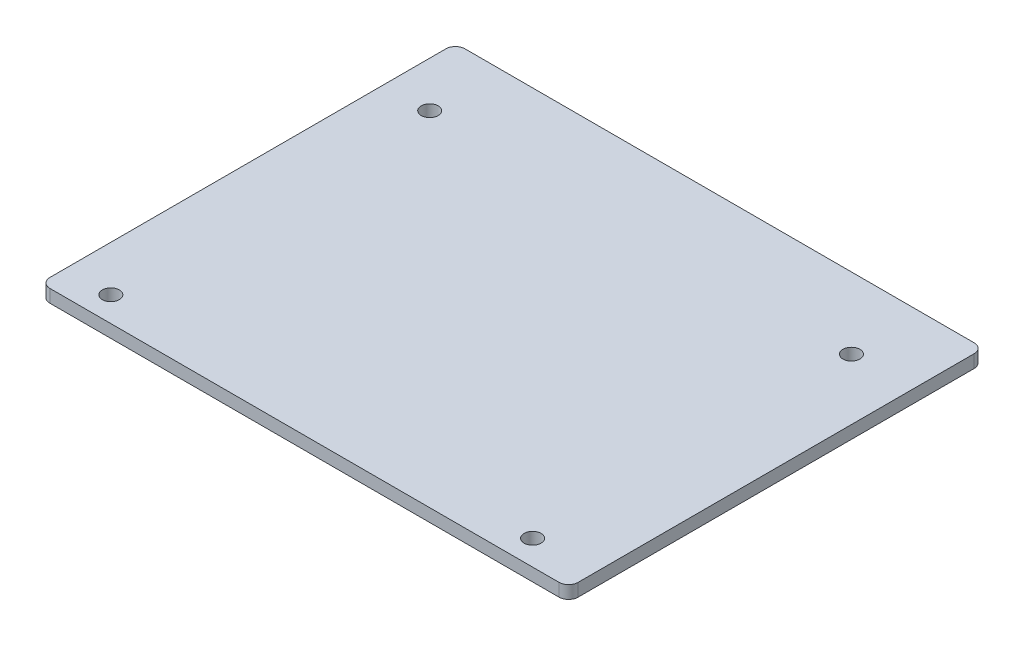
from build123d import *

# Parameters (mm, degrees)
SKETCH_1_W          = 103
SKETCH_1_H          = 81
EXTRUDE_1_DEPTH     = 2.5
FILLET_1_R          = 2
SKETCH_2_R          = 1.65
CUT_EXTRUDE_1_DEPTH = 66.56485339
CUT_EXTRUDE_2_DEPTH = 66.56485339


with BuildPart() as part:
    # 草图1 → 凸台-拉伸1 (new body)
    with BuildSketch(Plane(origin=(0, 0, 0), x_dir=(1, 0, 0), z_dir=(0, 1, 0))):
        Rectangle(SKETCH_1_W, SKETCH_1_H)
    extrude(amount=EXTRUDE_1_DEPTH)

    # 圆角1
    fillet_1_edges = [part.edges().sort_by_distance(p)[0] for p in [
        (51.5, 1.25, 40.5),
        (-51.5, 1.25, 40.5),
        (-51.5, 1.25, -40.5),
        (51.5, 1.25, -40.5),
    ]]
    fillet(fillet_1_edges, radius=FILLET_1_R)

    # 草图2 → 切除-拉伸1 (cut, through all)
    with BuildSketch(Plane(origin=(0, 2.5, 0), x_dir=(1, 0, 0), z_dir=(0, 1, 0))):
        with Locations(Location((-42.5, 26.5, 0), (0, 0, 270))):
            Circle(SKETCH_2_R)
        with Locations(Location((39.5, 26.5, 0), (0, 0, 270))):
            Circle(SKETCH_2_R)
        with Locations(Location((39.5, -35.5, 0), (0, 0, 270))):
            Circle(SKETCH_2_R)
        with Locations(Location((-42.5, -35.5, 0), (0, 0, 270))):
            Circle(SKETCH_2_R)
    extrude(amount=-CUT_EXTRUDE_1_DEPTH, mode=Mode.SUBTRACT)

    # 草图3 → 切除-拉伸2 (cut, through all)
    with BuildSketch(Plane(origin=(0, 2.5, 0), x_dir=(1, 0, 0), z_dir=(0, 1, 0))):
        with BuildLine():
            Line((49.5, 40.5), (-49.5, 40.5))
            ThreePointArc((-49.5, 40.5), (-50.914213562, 39.914213562), (-51.5, 38.5))
            Line((-51.5, 38.5), (-51.5, -38.5))
            ThreePointArc((-51.5, -38.5), (-50.914213562, -39.914213562), (-49.5, -40.5))
            Line((-49.5, -40.5), (49.5, -40.5))
            ThreePointArc((49.5, -40.5), (50.914213562, -39.914213562), (51.5, -38.5))
            Line((51.5, -38.5), (51.5, 38.5))
            ThreePointArc((51.5, 38.5), (50.914213562, 39.914213562), (49.5, 40.5))
        make_face()
        with BuildLine():
            Line((49.5, 40.35), (-49.5, 40.35))
            ThreePointArc((-49.5, 40.35), (-50.808147545, 39.808147545), (-51.35, 38.5))
            Line((-51.35, 38.5), (-51.35, -38.5))
            ThreePointArc((-51.35, -38.5), (-50.808147545, -39.808147545), (-49.5, -40.35))
            Line((-49.5, -40.35), (49.5, -40.35))
            ThreePointArc((49.5, -40.35), (50.808147545, -39.808147545), (51.35, -38.5))
            Line((51.35, -38.5), (51.35, 38.5))
            ThreePointArc((51.35, 38.5), (50.808147545, 39.808147545), (49.5, 40.35))
        make_face(mode=Mode.SUBTRACT)
    extrude(amount=-CUT_EXTRUDE_2_DEPTH, mode=Mode.SUBTRACT)


solid = part.part
